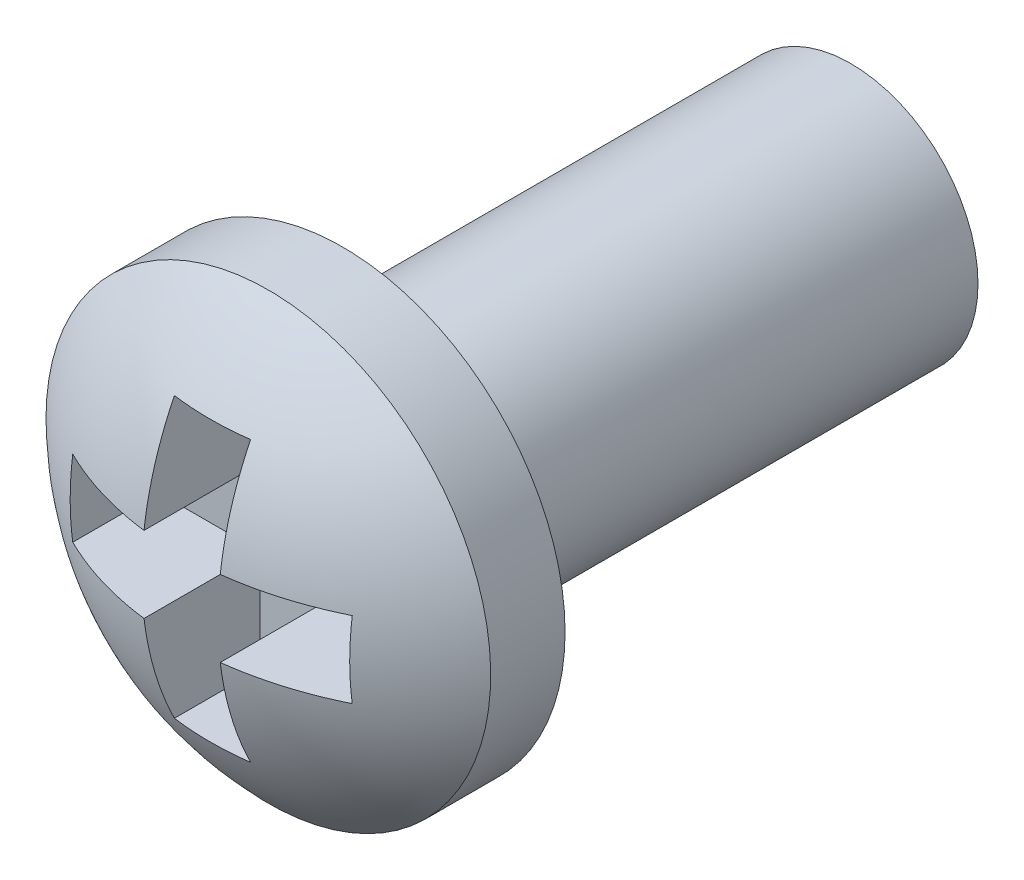
from build123d import *

# Parameters (mm, degrees)
SKETCH_1_R        = 1
EXTRUDE_198_DEPTH = 4
PH1_START         = 1.31
PH1_DEPTH         = 0.96


with BuildPart() as part:
    # 草图1 → Extrude 198 (new body)
    with BuildSketch(Plane.XY):
        Circle(SKETCH_1_R)
    extrude(amount=-EXTRUDE_198_DEPTH)

    # 草图6 → Revolve 324 (revolve)
    with BuildSketch(Plane(origin=(0, 0, 0), x_dir=(1, 0, 0), z_dir=(0, 1, 0)), mode=Mode.PRIVATE) as revolve_324_sk:
        with BuildLine():
            Line((0, 0), (1.75, 0))
            Line((1.75, 0), (1.75, -0.585357107))
            ThreePointArc((1.75, -0.585357107), (0.945147404, -1.114453798), (0, -1.3))
            Line((0, -1.3), (0, 0))
        make_face()
    revolve(revolve_324_sk.sketch.rotate(Axis((0, 0, -2), (0, 0, 1)), 180), axis=Axis((0, 0, -2), (0, 0, 1)))

    # 草图7 → 十字槽_PH1_简化 (cut)
    with BuildSketch(Plane.XY.offset(PH1_START)):
        Polygon((-0.3, -1.1), (0.3, -1.1), (0.3, -0.3), (1.1, -0.3), (1.1, 0.3), (0.3, 0.3), (0.3, 1.1), (-0.3, 1.1), (-0.3, 0.3), (-1.1, 0.3), (-1.1, -0.3), (-0.3, -0.3), align=None)
    extrude(amount=-PH1_DEPTH, mode=Mode.SUBTRACT)


solid = part.part
